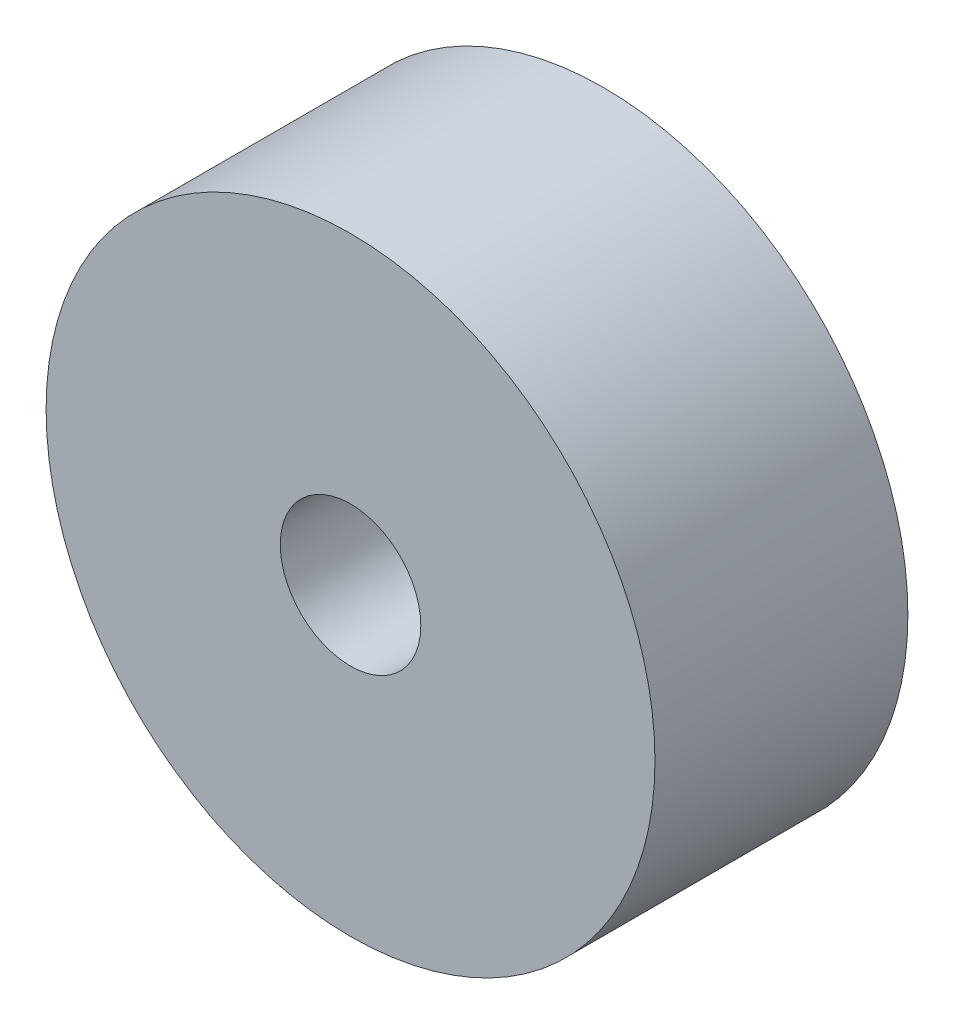
from build123d import *

# Parameters (mm, degrees)
SKETCH_1_R      = 32.5
SKETCH_1_R_2    = 7.5
EXTRUDE_1_DEPTH = 27


with BuildPart() as part:
    # 草图1 → 凸台-拉伸1 (new body)
    with BuildSketch(Plane.XY):
        Circle(SKETCH_1_R)
        Circle(SKETCH_1_R_2, mode=Mode.SUBTRACT)
    extrude(amount=EXTRUDE_1_DEPTH)


solid = part.part
